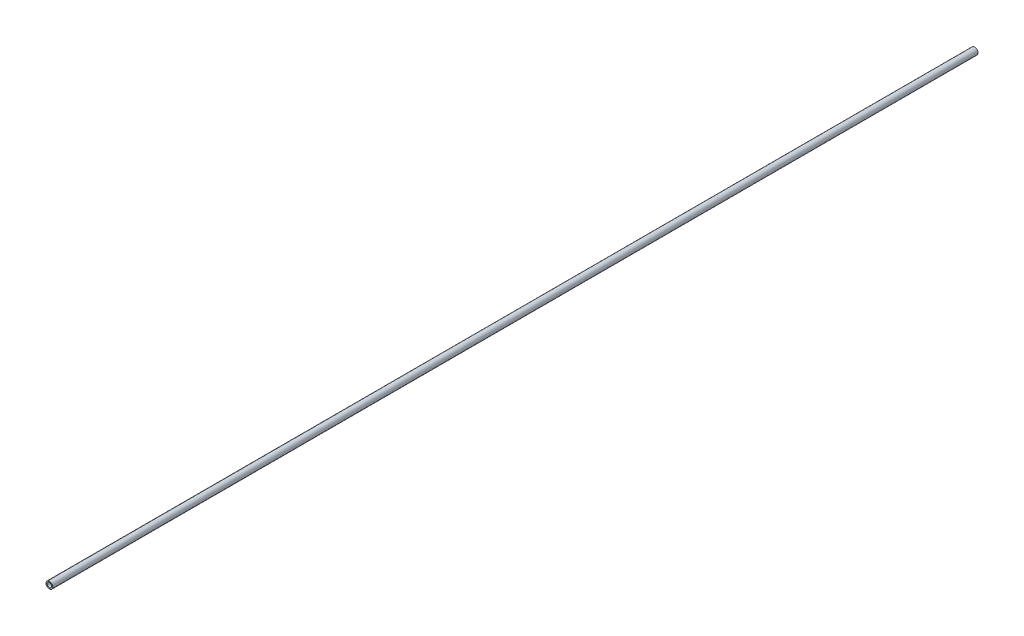
from build123d import *

# Parameters (mm, degrees)
SKETCH1_R           = 3
SKETCH1_R_2         = 2
BOSS_EXTRUDE1_DEPTH = 820


with BuildPart() as part:
    # Sketch1 → Boss-Extrude1 (new body)
    with BuildSketch(Plane.XY):
        with Locations(Location((0, 0, 0), (0, 0, 180))):
            Circle(SKETCH1_R)
        with Locations(Location((0, 0, 0), (0, 0, 180))):
            Circle(SKETCH1_R_2, mode=Mode.SUBTRACT)
    extrude(amount=BOSS_EXTRUDE1_DEPTH)


solid = part.part
